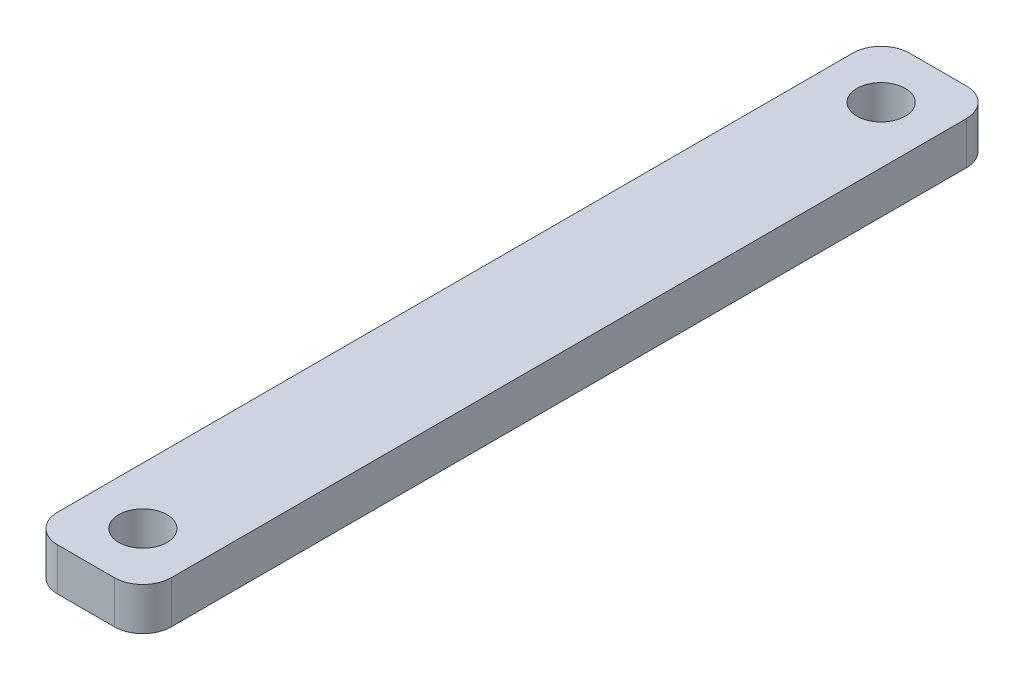
from build123d import *

# Parameters (mm, degrees)
SKETCH_1_R      = 1.7
EXTRUDE_1_DEPTH = 3


with BuildPart() as part:
    # 草圖1 → 填料-伸長1 (new body)
    with BuildSketch(Plane(origin=(0, 0, 0), x_dir=(1, 0, 0), z_dir=(0, 1, 0))):
        with BuildLine():
            Line((-2, 30), (2, 30))
            ThreePointArc((2, 30), (3.414213562, 29.414213562), (4, 28))
            Line((4, 28), (4, -28))
            ThreePointArc((4, -28), (3.414213562, -29.414213562), (2, -30))
            Line((2, -30), (-2, -30))
            ThreePointArc((-2, -30), (-3.414213562, -29.414213562), (-4, -28))
            Line((-4, -28), (-4, 28))
            ThreePointArc((-4, 28), (-3.414213562, 29.414213562), (-2, 30))
        make_face()
        with Locations(Location((0, 26, 0), (0, 0, 270))):
            Circle(SKETCH_1_R, mode=Mode.SUBTRACT)
        with Locations(Location((0, -26, 0), (0, 0, 90))):
            Circle(SKETCH_1_R, mode=Mode.SUBTRACT)
    extrude(amount=EXTRUDE_1_DEPTH)


solid = part.part
